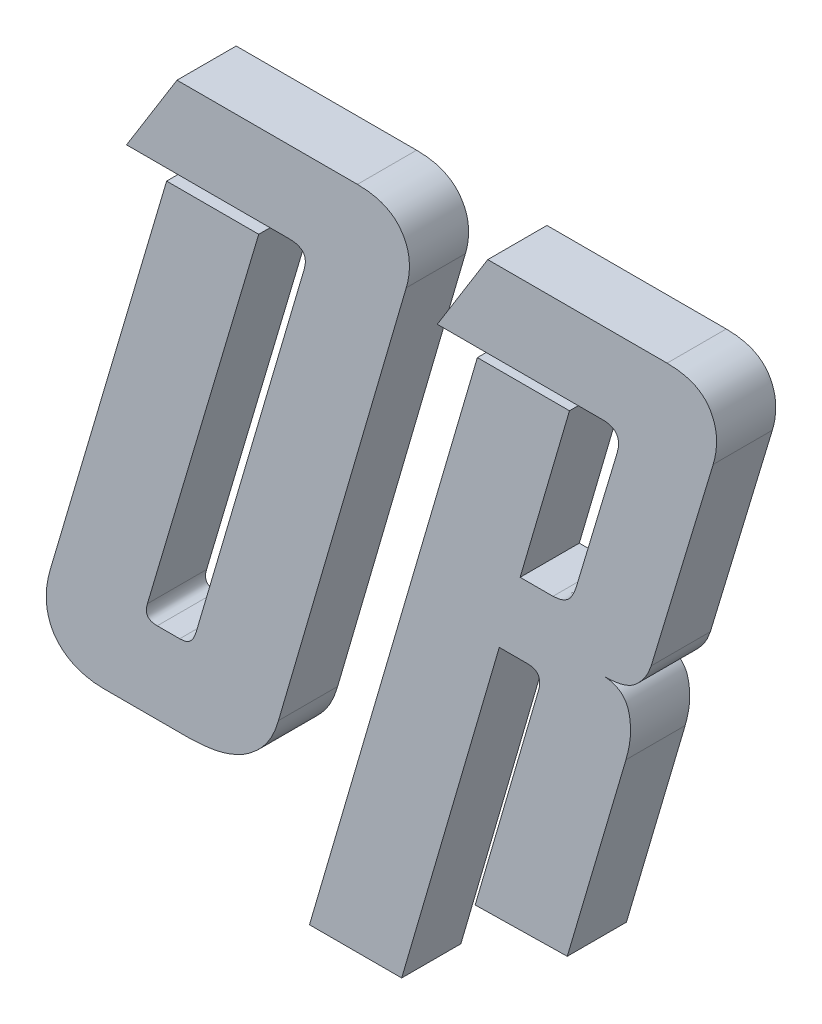
from build123d import *

# Parameters (mm, degrees)
BOSS_EXTRU_1_DEPTH   = 2
BOSS_EXTRU_1_2_DEPTH = 2


with BuildPart() as part:
    # Esquisse1 → Boss.-Extru.1 (new body)
    with BuildSketch(Plane.XY):
        with BuildLine():
            add(Edge.make_bspline(
                [(9.803885135, 15.663154561), (9.816409793, 15.712904153), (9.839659183, 15.805253798), (9.846149572, 15.938306858), (9.827265222, 16.053553889), (9.77282614, 16.148463232), (9.688153375, 16.218534536), (9.579091426, 16.27124441), (9.441331185, 16.298352791), (9.340962068, 16.302044781), (9.286338682, 16.304054054)],
                knots=[0, 0, 0, 0, 1.200744757, 2.228929884, 3.104743097, 3.903101275, 4.735424252, 5.644967986, 6.718332635, 8, 8, 8, 8], degree=3))
            Line((9.286338682, 16.304054054), (3.799809966, 16.304054054))
            Line((3.799809966, 16.304054054), (5.505299831, 19.05))
            Line((5.505299831, 19.05), (11.603230574, 19.05))
            add(Edge.make_bspline(
                [(11.603230574, 19.05), (11.68824262, 19.047896263), (11.852545246, 19.043830373), (12.088620561, 19.014099347), (12.305851815, 18.967079914), (12.502799226, 18.896774588), (12.681276033, 18.80798568), (12.841971855, 18.701019071), (12.979785219, 18.569988421), (13.097013166, 18.421799764), (13.197447048, 18.261684848), (13.272218183, 18.087678978), (13.327127625, 17.904277464), (13.355234183, 17.710184118), (13.363372801, 17.507037584), (13.348727902, 17.294311327), (13.315109158, 17.07116462), (13.273687954, 16.922244886), (13.252407095, 16.845734797)],
                knots=[0, 0, 0, 0, 1.227025702, 2.371470339, 3.429649678, 4.429654124, 5.381889622, 6.301745996, 7.205530584, 8.114459748, 9.024121477, 9.9255999, 10.840282126, 11.780196128, 12.748817052, 13.770322343, 14.854464549, 16, 16, 16, 16], degree=3))
            Line((13.252407095, 16.845734797), (8.935050676, 2.019235642))
            add(Edge.make_bspline(
                [(8.935050676, 2.019235642), (8.905603638, 1.923829672), (8.848514798, 1.738866552), (8.734619241, 1.478977208), (8.6013741, 1.244562414), (8.446022548, 1.037706876), (8.280132329, 0.850688776), (8.098115046, 0.688523921), (7.91166126, 0.538685851), (7.645802968, 0.371446897), (7.287882261, 0.20734529), (6.83027548, 0.080074421), (6.355435913, 0.016058195), (6.035524402, 0.005357408), (5.875358953, 0)],
                knots=[0, 0, 0, 0, 0.904305839, 1.753173633, 2.56606415, 3.342155626, 4.093630258, 4.827654605, 5.54882605, 6.258993598, 7.668964108, 9.099978565, 10.548088398, 12, 12, 12, 12], degree=3))
            Line((5.875358953, 0), (3.022149493, 0))
            add(Edge.make_bspline(
                [(3.022149493, 0), (2.939784699, 0.001859381), (2.778868248, 0.00549206), (2.543113775, 0.039920762), (2.317285433, 0.089467356), (2.102951987, 0.161461504), (1.904436206, 0.25437857), (1.725410538, 0.369372007), (1.562417554, 0.49985257), (1.422844741, 0.654627603), (1.302810827, 0.827630135), (1.209060792, 1.021308482), (1.142776616, 1.234886955), (1.095503893, 1.466467906), (1.081341853, 1.719795942), (1.095343569, 1.993031733), (1.141638538, 2.286822184), (1.194961805, 2.486272646), (1.222804054, 2.590413851)],
                knots=[0, 0, 0, 0, 1.038589481, 2.029096732, 3.000411816, 3.952682251, 4.875924781, 5.758235803, 6.631926692, 7.502116385, 8.378061026, 9.280964095, 10.204757568, 11.193465298, 12.255788728, 13.396298177, 14.640501287, 16, 16, 16, 16], degree=3))
            Line((1.222804054, 2.590413851), (5.154011824, 15.920586993))
            Line((5.154011824, 15.920586993), (8.267335304, 15.920586993))
            Line((8.267335304, 15.920586993), (4.505067568, 3.225950169))
            add(Edge.make_bspline(
                [(4.505067568, 3.225950169), (4.494912881, 3.188637516), (4.476261524, 3.120104465), (4.467416901, 3.021318635), (4.475422066, 2.935434328), (4.509964632, 2.864613473), (4.563226616, 2.807570062), (4.639322457, 2.770768603), (4.732807448, 2.750320602), (4.800815992, 2.747481105), (4.837584459, 2.745945946)],
                knots=[0, 0, 0, 0, 1.268310745, 2.32953697, 3.247763845, 4.062404139, 4.872795954, 5.766252807, 6.79233614, 8, 8, 8, 8], degree=3))
            Line((4.837584459, 2.745945946), (5.596473818, 2.745945946))
            add(Edge.make_bspline(
                [(5.596473818, 2.745945946), (5.634103248, 2.747605816), (5.705562241, 2.750757941), (5.806074156, 2.771006828), (5.891232253, 2.808798608), (5.987623668, 2.882759994), (6.082803758, 3.022628189), (6.128939509, 3.152200592), (6.154244088, 3.223268581)],
                knots=[0, 0, 0, 0, 0.844699856, 1.604100825, 2.286462665, 2.916384278, 4.308695666, 6, 6, 6, 6], degree=3))
            Line((6.154244088, 3.223268581), (9.803885135, 15.663154561))
        make_face()
    extrude(amount=BOSS_EXTRU_1_DEPTH)


with BuildPart() as body_2:
    # Esquisse1 → Boss.-Extru.1 2 (new body)
    with BuildSketch(Plane.XY):
        with BuildLine():
            add(Edge.make_bspline(
                [(18.212808277, 10.297297297), (18.295918717, 10.304231778), (18.458683838, 10.317812401), (18.651799119, 10.403174373), (18.783529757, 10.51928371), (18.868943797, 10.649235383), (18.950818794, 10.811558355), (18.990521419, 10.935662023), (19.011921453, 11.002554899)],
                knots=[0, 0, 0, 0, 1.287265703, 2.521006488, 3.188322154, 3.983954908, 4.91333547, 6, 6, 6, 6], degree=3))
            Line((19.011921453, 11.002554899), (20.382212838, 15.580025338))
            add(Edge.make_bspline(
                [(20.382212838, 15.580025338), (20.396642206, 15.635969028), (20.423386947, 15.739660302), (20.433184109, 15.890007697), (20.413130714, 16.019111457), (20.364303885, 16.126616895), (20.283303647, 16.210284539), (20.171664035, 16.264627056), (20.034861699, 16.300081609), (19.934655406, 16.302664666), (19.880755912, 16.304054054)],
                knots=[0, 0, 0, 0, 1.269702279, 2.353385088, 3.291366245, 4.118613865, 4.911701318, 5.800525574, 6.816934998, 8, 8, 8, 8], degree=3))
            Line((19.880755912, 16.304054054), (14.303053209, 16.304054054))
            Line((14.303053209, 16.304054054), (16.008543074, 19.05))
            Line((16.008543074, 19.05), (22.068931588, 19.05))
            add(Edge.make_bspline(
                [(22.068931588, 19.05), (22.15394113, 19.047951653), (22.316464953, 19.044035562), (22.549960633, 19.014165272), (22.762858807, 18.966060825), (22.957179159, 18.901310345), (23.128515517, 18.810431195), (23.280192277, 18.70336331), (23.411632361, 18.575621897), (23.517866758, 18.427313968), (23.603450785, 18.265134782), (23.671026247, 18.093539129), (23.716953928, 17.911566832), (23.740935983, 17.719772333), (23.742292178, 17.518491613), (23.726254943, 17.307561109), (23.68884247, 17.087505199), (23.647938194, 16.940164418), (23.626934122, 16.864505912)],
                knots=[0, 0, 0, 0, 1.251338017, 2.392345991, 3.458656697, 4.461694018, 5.397650846, 6.303325578, 7.187420856, 8.082419285, 8.977320952, 9.881560306, 10.791242046, 11.733101695, 12.720213325, 13.749750695, 14.844512033, 16, 16, 16, 16], degree=3))
            Line((23.626934122, 16.864505912), (21.53261402, 9.921875))
            add(Edge.make_bspline(
                [(21.53261402, 9.921875), (21.507413321, 9.852380032), (21.456973203, 9.713283324), (21.350545111, 9.513576411), (21.212435809, 9.328474623), (21.053030698, 9.149837602), (20.851128151, 8.996529077), (20.596900937, 8.894999309), (20.300593096, 8.829658609), (20.087641735, 8.823180727), (19.974611486, 8.819742399)],
                knots=[0, 0, 0, 0, 0.858061207, 1.717440721, 2.616729748, 3.535235509, 4.492594278, 5.530155533, 6.689056816, 8, 8, 8, 8], degree=3))
            add(Edge.make_bspline(
                [(19.974611486, 8.819742399), (20.027628658, 8.81419687), (20.129693255, 8.803521042), (20.27309683, 8.762185313), (20.400598827, 8.705832246), (20.513512551, 8.633871368), (20.605055661, 8.539073707), (20.684472118, 8.432067947), (20.743720273, 8.305100232), (20.799813691, 8.1118793), (20.835016452, 7.84420689), (20.835302838, 7.500459073), (20.781083345, 7.129806974), (20.714673849, 6.87855463), (20.679869088, 6.746875)],
                knots=[0, 0, 0, 0, 0.748232156, 1.440439236, 2.087360142, 2.704291393, 3.308549052, 3.929435439, 4.570224255, 5.265958673, 6.751725874, 8.347722503, 10.085866424, 12, 12, 12, 12], degree=3))
            Line((20.679869088, 6.746875), (18.695494088, 0))
            Line((18.695494088, 0), (15.582170608, -0.053631757))
            Line((15.582170608, -0.053631757), (17.732804054, 7.328779561))
            add(Edge.make_bspline(
                [(17.732804054, 7.328779561), (17.743157939, 7.370537136), (17.762356691, 7.447966366), (17.768841812, 7.560804024), (17.753584394, 7.660340167), (17.715473563, 7.746050368), (17.654720853, 7.817596302), (17.564354256, 7.862692412), (17.453189811, 7.8926271), (17.370150277, 7.893903634), (17.325202703, 7.894594595)],
                knots=[0, 0, 0, 0, 1.198272128, 2.22190316, 3.132016759, 3.980240005, 4.810681926, 5.692336566, 6.750909741, 8, 8, 8, 8], degree=3))
            Line((17.325202703, 7.894594595), (16.397373311, 7.894594595))
            Line((16.397373311, 7.894594595), (13.09902027, -3.432432432))
            Line((13.09902027, -3.432432432), (9.983015203, -3.432432432))
            Line((9.983015203, -3.432432432), (15.657255068, 16.006397804))
            Line((15.657255068, 16.006397804), (18.770578547, 16.006397804))
            Line((18.770578547, 16.006397804), (17.102630912, 10.297297297))
            Line((17.102630912, 10.297297297), (18.212808277, 10.297297297))
        make_face()
    extrude(amount=BOSS_EXTRU_1_2_DEPTH)


solid = Compound([part.part, body_2.part])
